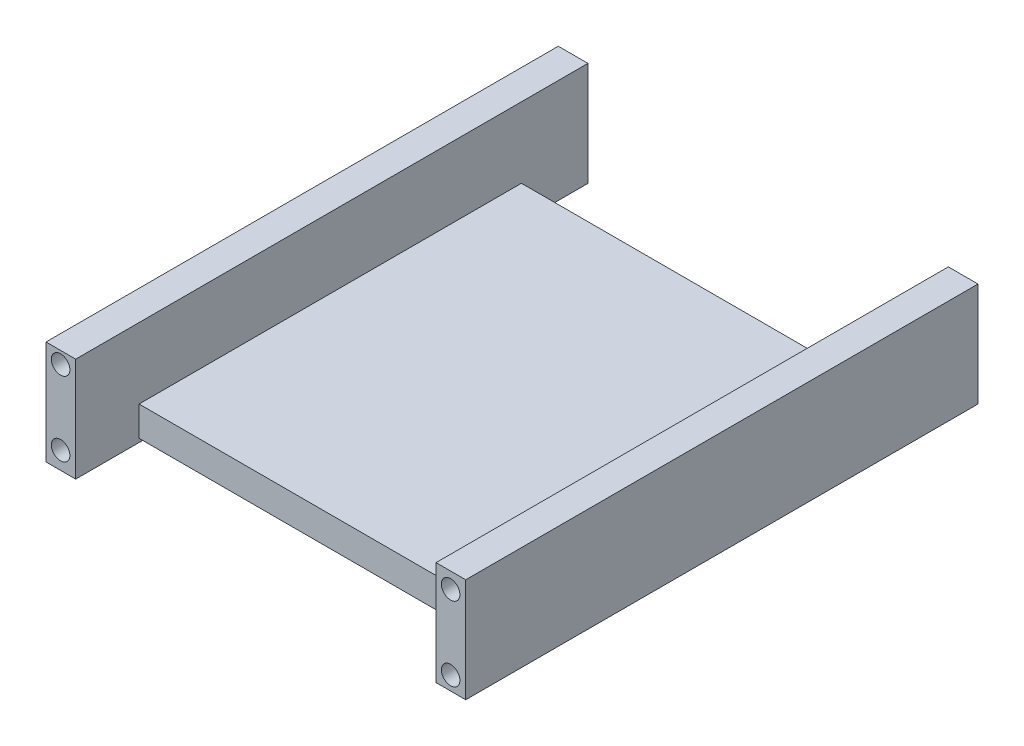
from build123d import *

# Parameters (mm, degrees)
SKETCH_1_W          = 138
SKETCH_1_H          = 28
EXTRUDE_1_DEPTH     = 8
SKETCH_2_W          = 103
SKETCH_2_H          = 8
EXTRUDE_2_DEPTH     = 97
SKETCH_3_W          = 138
SKETCH_3_H          = 28
EXTRUDE_3_DEPTH     = 8
SKETCH_4_R          = 2.5
CUT_EXTRUDE_1_DEPTH = 5
SKETCH_5_R          = 2.5
CUT_EXTRUDE_2_DEPTH = 5


with BuildPart() as part:
    # 草图1 → 凸台-拉伸1 (new body)
    with BuildSketch(Plane(origin=(0, 0, 0), x_dir=(0, 0, -1), z_dir=(1, 0, 0))):
        Rectangle(SKETCH_1_W, SKETCH_1_H)
    extrude(amount=EXTRUDE_1_DEPTH)

    # 草图2 → 凸台-拉伸2 (add)
    with BuildSketch(Plane.ZY):
        with Locations((0.5, -10)):
            Rectangle(SKETCH_2_W, SKETCH_2_H)
    extrude(amount=EXTRUDE_2_DEPTH)

    # 草图3 → 凸台-拉伸3 (add)
    with BuildSketch(Plane.ZY.offset(97)):
        with Locations((0.070183463, -0.989678925)):
            Rectangle(SKETCH_3_W, SKETCH_3_H)
    extrude(amount=EXTRUDE_3_DEPTH)

    # 草图4 → 切除-拉伸1 (cut)
    with BuildSketch(Plane.XY.offset(69.070183463)):
        with Locations((-101.073349409, 9.731398078)):
            Circle(SKETCH_4_R)
        with Locations((3.926650591, 9.731398078)):
            Circle(SKETCH_4_R)
        with Locations((3.926650591, -10.268601922)):
            Circle(SKETCH_4_R)
        with Locations((-101.073349409, -10.268601922)):
            Circle(SKETCH_4_R)
    extrude(amount=-CUT_EXTRUDE_1_DEPTH, mode=Mode.SUBTRACT)

    # 草图5 → 切除-拉伸2 (cut)
    with BuildSketch(Plane(origin=(0, 0, -69), x_dir=(-1, 0, 0), z_dir=(0, 0, -1))):
        with Locations((-4, 10)):
            Circle(SKETCH_5_R)
        with Locations((101, 10)):
            Circle(SKETCH_5_R)
        with Locations((101, -10)):
            Circle(SKETCH_5_R)
        with Locations((-4, -10)):
            Circle(SKETCH_5_R)
    extrude(amount=-CUT_EXTRUDE_2_DEPTH, mode=Mode.SUBTRACT)


solid = part.part
